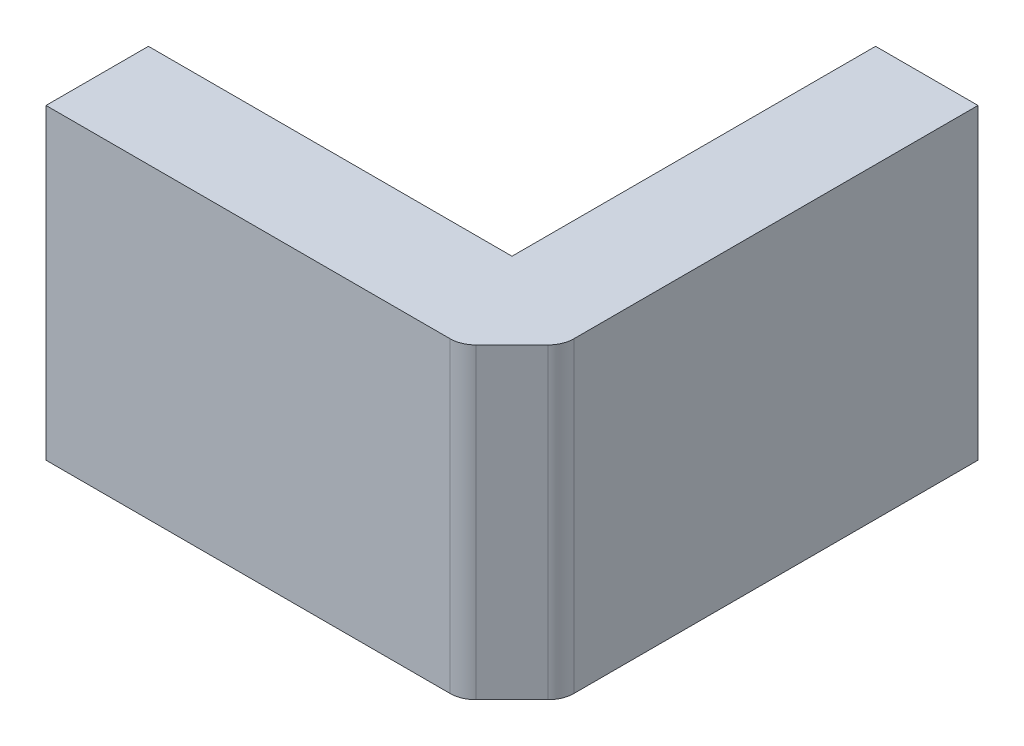
from build123d import *

# Parameters (mm, degrees)
BOSS_EXTRUDE1_DEPTH = 60
CHAMFER1_SIZE       = 10
FILLET1_R           = 5


with BuildPart() as part:
    # Sketch1 → Boss-Extrude1 (new body)
    with BuildSketch(Plane(origin=(0, 0, 0), x_dir=(1, 0, 0), z_dir=(0, 1, 0))):
        Polygon((25.5, 45.5), (25.5, -25.5), (-45.5, -25.5), (-45.5, -45.5), (45.5, -45.5), (45.5, 45.5), align=None)
    extrude(amount=BOSS_EXTRUDE1_DEPTH)

    # Chamfer1
    chamfer1_edges = [part.edges().sort_by_distance(p)[0] for p in [
        (45.5, 30, 45.5),
    ]]
    chamfer(chamfer1_edges, length=CHAMFER1_SIZE)

    # Fillet1
    fillet1_edges = [part.edges().sort_by_distance(p)[0] for p in [
        (45.5, 30, 35.5),
        (35.5, 30, 45.5),
    ]]
    fillet(fillet1_edges, radius=FILLET1_R)


solid = part.part
